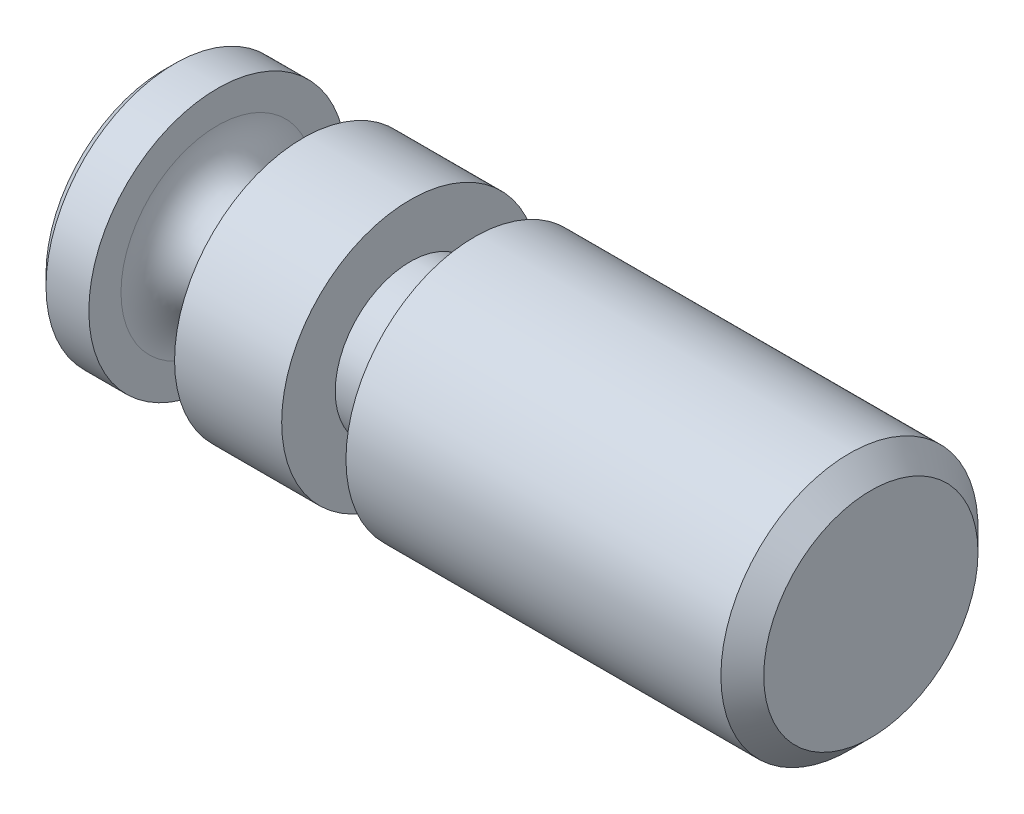
from build123d import *


with BuildPart() as part:
    # Esquisse1 → Révolution2 (revolve)
    with BuildSketch(Plane.XY, mode=Mode.PRIVATE) as r_volution2_sk:
        with BuildLine():
            Line((0, 0), (-17.5, 0))
            Line((-17.5, 0), (-17.5, 2.5))
            Line((-17.5, 2.5), (-20.5, 2.5))
            Line((-20.5, 2.5), (-20.5, 0))
            Line((-20.5, 0), (-25.5, 0))
            Line((-25.5, 0), (-25.5, 1.5))
            ThreePointArc((-25.5, 1.5), (-27.5, 3.5), (-29.5, 1.5))
            Line((-29.5, 1.5), (-29.5, 0))
            Line((-29.5, 0), (-31.5, 0))
            Line((-31.5, 0), (-32, 0.5))
            Line((-32, 0.5), (-32, 6))
            Line((-32, 6), (1, 6))
            Line((1, 6), (1, 1))
            Line((1, 1), (0, 0))
        make_face()
    revolve(r_volution2_sk.sketch.rotate(Axis((-32, 6, 0), (1, 0, 0)), 270), axis=Axis((-32, 6, 0), (1, 0, 0)))


solid = part.part
